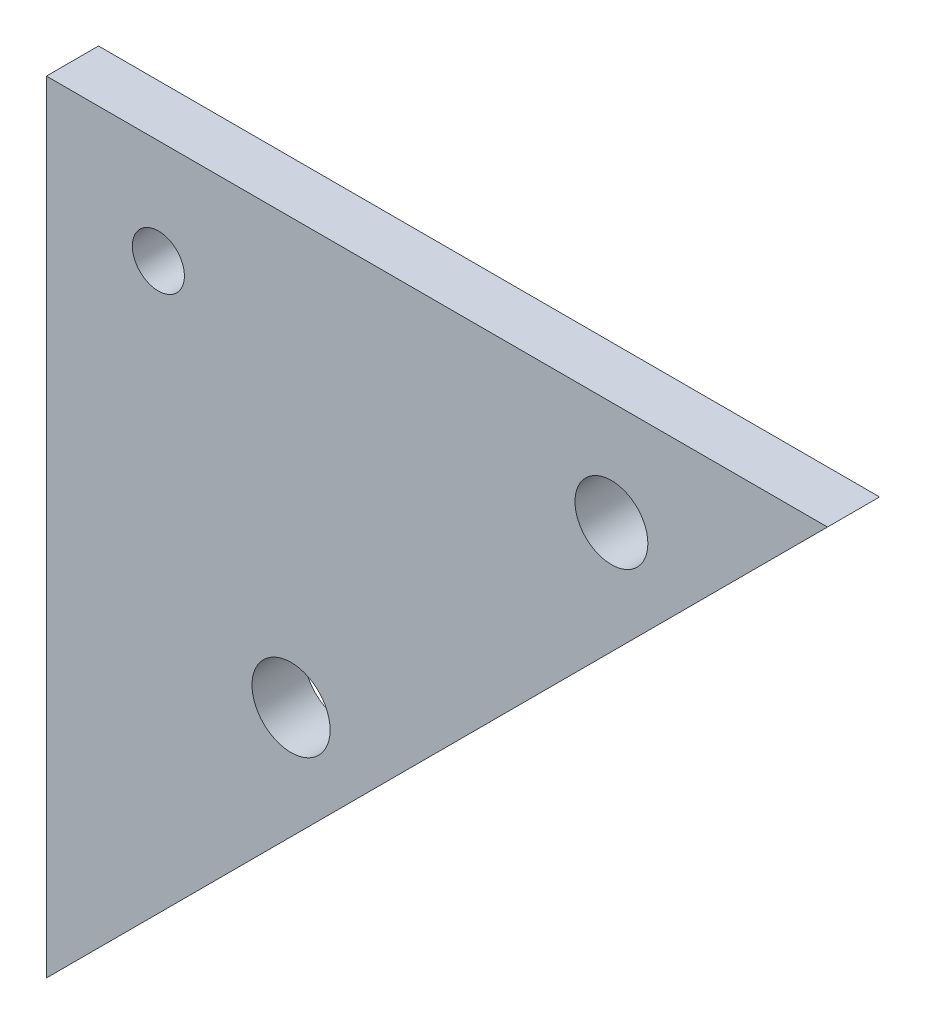
from build123d import *

# Parameters (mm, degrees)
BOSS_EXTRUDE1_DEPTH = 2.54
SKETCH2_R           = 1.27
SKETCH2_R_2         = 1.778
SKETCH2_R_3         = 1.905
CUT_EXTRUDE1_DEPTH  = 46.409263418


with BuildPart() as part:
    # Sketch1 → Boss-Extrude1 (new body)
    with BuildSketch(Plane.XY):
        Polygon((-38.1, 24.575182688), (-38.1, -13.524817312), (0, 24.575182688), align=None)
    extrude(amount=BOSS_EXTRUDE1_DEPTH)

    # Sketch2 → Cut-Extrude1 (cut, through all)
    with BuildSketch(Plane.XY.offset(2.54)):
        with Locations((-32.639, 19.495182688)):
            Circle(SKETCH2_R)
        with Locations((-10.541, 19.495182688)):
            Circle(SKETCH2_R_2)
        with Locations((-26.166645651, 3.869537037)):
            Circle(SKETCH2_R_3)
    extrude(amount=-CUT_EXTRUDE1_DEPTH, mode=Mode.SUBTRACT)


solid = part.part
